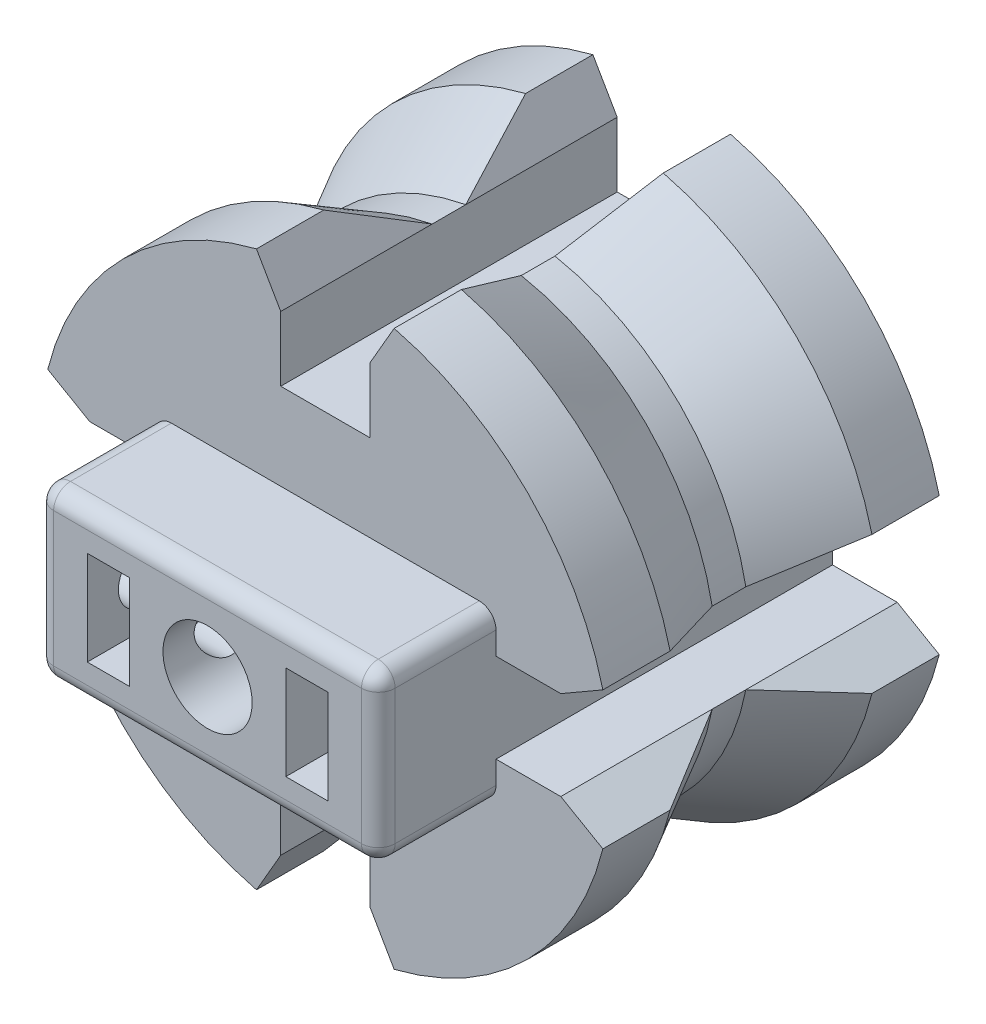
from build123d import *

# Parameters (mm, degrees)
SKETCH1_R           = 2.65
BOSS_EXTRUDE1_DEPTH = 20
SKETCH2_W           = 20.3
SKETCH2_H           = 10
SKETCH2_R           = 2.65
SKETCH2_W_2         = 2.5
SKETCH2_H_2         = 5.6
BOSS_EXTRUDE2_DEPTH = 7
SKETCH3_R           = 1.65
CUT_EXTRUDE5_DEPTH  = 10
FILLET1_R           = 1
SKETCH7_W           = 3.85
SKETCH7_H           = 5.298601426
SKETCH7_W_2         = 5.298601426
SKETCH7_H_2         = 3.85
CUT_EXTRUDE6_DEPTH  = 20


with BuildPart() as part:
    # Sketch1 → Boss-Extrude1 (new body)
    with BuildSketch(Plane.XY):
        with BuildLine():
            Line((4.092676386, 16.5), (2.649300713, 14))
            Line((2.649300713, 14), (-2.649300713, 14))
            Line((-2.649300713, 14), (-4.092676386, 16.5))
            ThreePointArc((-4.092676386, 16.5), (-12.02081528, 12.02081528), (-16.5, 4.092676386))
            Line((-16.5, 4.092676386), (-14, 2.649300713))
            Line((-14, 2.649300713), (-14, -2.649300713))
            Line((-14, -2.649300713), (-16.5, -4.092676386))
            ThreePointArc((-16.5, -4.092676386), (-12.02081528, -12.02081528), (-4.092676386, -16.5))
            Line((-4.092676386, -16.5), (-2.649300713, -14))
            Line((-2.649300713, -14), (2.649300713, -14))
            Line((2.649300713, -14), (4.092676386, -16.5))
            ThreePointArc((4.092676386, -16.5), (12.02081528, -12.02081528), (16.5, -4.092676386))
            Line((16.5, -4.092676386), (14, -2.649300713))
            Line((14, -2.649300713), (14, 2.649300713))
            Line((14, 2.649300713), (16.5, 4.092676386))
            ThreePointArc((16.5, 4.092676386), (12.02081528, 12.02081528), (4.092676386, 16.5))
        make_face()
        Circle(SKETCH1_R, mode=Mode.SUBTRACT)
    extrude(amount=BOSS_EXTRUDE1_DEPTH)

    # Sketch2 → Boss-Extrude2 (add)
    with BuildSketch(Plane.XY.offset(20)):
        Rectangle(SKETCH2_W, SKETCH2_H)
        Circle(SKETCH2_R, mode=Mode.SUBTRACT)
        with Locations((-5.9, 0)):
            Rectangle(SKETCH2_W_2, SKETCH2_H_2, mode=Mode.SUBTRACT)
        with Locations((5.9, 0)):
            Rectangle(SKETCH2_W_2, SKETCH2_H_2, mode=Mode.SUBTRACT)
    extrude(amount=BOSS_EXTRUDE2_DEPTH)

    # Sketch3 → Cut-Extrude5 (cut)
    with BuildSketch(Plane.ZY.offset(10.15)):
        with Locations((23.5, 0)):
            Circle(SKETCH3_R)
    extrude(amount=-CUT_EXTRUDE5_DEPTH, mode=Mode.SUBTRACT)

    # Fillet1
    fillet1_edges = [part.edges().sort_by_distance(p)[0] for p in [
        (10.15, 0, 27),
        (0, 5, 27),
        (-10.15, 0, 27),
        (0, -5, 27),
        (10.15, -5, 23.5),
        (10.15, 5, 23.5),
        (-10.15, 5, 23.5),
        (-10.15, -5, 23.5),
    ]]
    fillet(fillet1_edges, radius=FILLET1_R)

    # Cut-Sweep2: sweep along a path in Sketch6
    with BuildLine(Plane.XY.offset(20)) as cut_sweep2_path:
        CenterArc((0, 0), 17, 0, 360)
    # Sketch5 → Cut-Sweep2 (sweep, cut)
    with BuildSketch(Plane(origin=(-4.075202292, 2.35281914, 0), x_dir=(0, 0, 1), z_dir=(-0.8660254037844398, 0.499999999999998, 0))):
        Polygon((9, 13.449006009), (11, 13.449006009), (16, 16.335757355), (4, 16.335757355), align=None)
    sweep(path=cut_sweep2_path.line, mode=Mode.SUBTRACT)

    # Sketch7 → Cut-Extrude6 (cut)
    with BuildSketch(Plane.XY.offset(20)):
        with Locations((-12.075, 0)):
            Rectangle(SKETCH7_W, SKETCH7_H)
        with Locations((0, 12.075)):
            Rectangle(SKETCH7_W_2, SKETCH7_H_2)
        with Locations((12.075, 0)):
            Rectangle(SKETCH7_W, SKETCH7_H)
        with Locations((0, -12.075)):
            Rectangle(SKETCH7_W_2, SKETCH7_H_2)
    extrude(amount=-CUT_EXTRUDE6_DEPTH, mode=Mode.SUBTRACT)


solid = part.part
